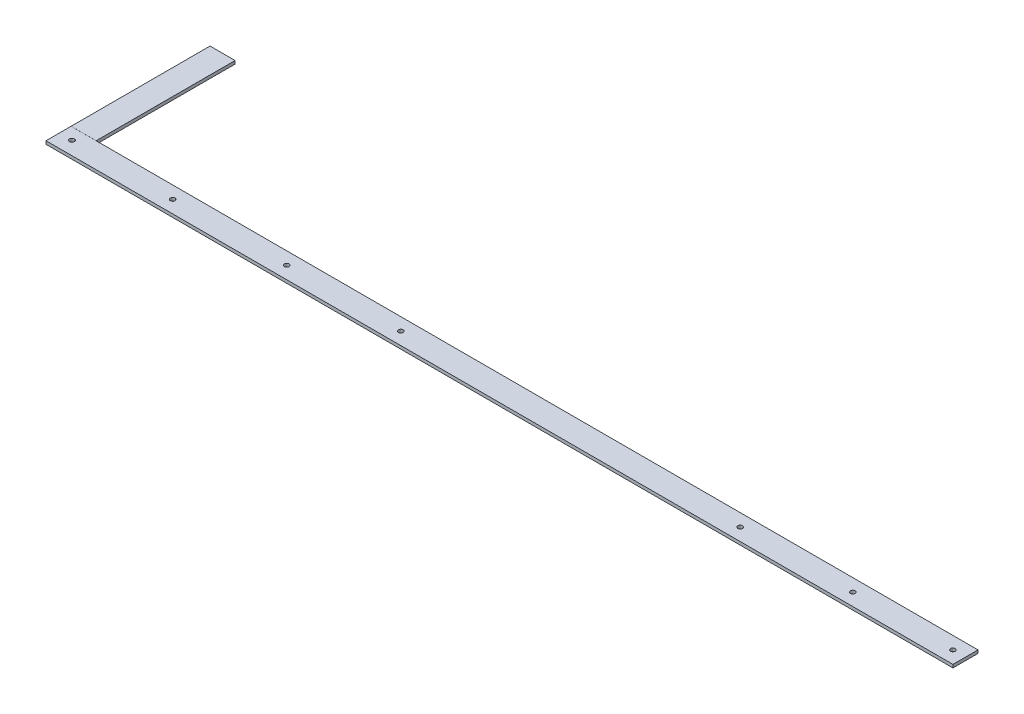
from build123d import *

# Parameters (mm, degrees)
CROQUIS2_W              = 50.8
CROQUIS2_H              = 128.69
SALIENTE_EXTRUIR1_DEPTH = 6.31
CROQUIS3_W              = 50.8
CROQUIS3_H              = 6.31
SALIENTE_EXTRUIR2_DEPTH = 507.13
CROQUIS4_W              = 50.8
CROQUIS4_H              = 6.31
SALIENTE_EXTRUIR3_DEPTH = 1787.3
CROQUIS9_W              = 50.8
CROQUIS9_H              = 6.31
SALIENTE_EXTRUIR4_DEPTH = 98
CROQUIS12_R             = 5
CORTAR_EXTRUIR1_DEPTH   = 10
CORTAR_EXTRUIR2_DEPTH   = 73
CROQUIS16_W             = 47.2
CROQUIS16_H             = 71.54029971
CORTAR_EXTRUIR5_DEPTH   = 10
CROQUIS25_W             = 50.8
CROQUIS25_H             = 0.1
CORTAR_EXTRUIR14_DEPTH  = 50.8
CROQUIS24_W             = 50.8
CROQUIS24_H             = 0.1
CORTAR_EXTRUIR15_DEPTH  = 50.8
CROQUIS26_R             = 4.7625
CORTAR_EXTRUIR16_DEPTH  = 33
CROQUIS27_R             = 5
CORTAR_EXTRUIR17_DEPTH  = 33
CROQUIS32_R             = 5
CORTAR_EXTRUIR22_DEPTH  = 50
CROQUIS33_R             = 5
CORTAR_EXTRUIR23_DEPTH  = 50
CROQUIS34_R             = 4.765
CROQUIS34_R_2           = 4.7625
CORTAR_EXTRUIR24_DEPTH  = 10
CROQUIS35_R             = 4.765
CROQUIS35_R_2           = 4.7625
CORTAR_EXTRUIR25_DEPTH  = 10
CROQUIS36_R             = 5
CORTAR_EXTRUIR26_DEPTH  = 10
CROQUIS37_W             = 50.8
CROQUIS37_H             = 6.31
SALIENTE_EXTRUIR5_DEPTH = 100
CORTAR_EXTRUIR27_DEPTH  = 135
CROQUIS40_W             = 50.8
CROQUIS40_H             = 181
CORTAR_EXTRUIR28_DEPTH  = 74
CROQUIS42_W             = 161.497999248
CROQUIS42_H             = 238.597734352
CORTAR_EXTRUIR30_DEPTH  = 87


with BuildPart() as part:
    # Croquis2 → Saliente-Extruir1 (new body)
    with BuildSketch(Plane.XY):
        Rectangle(CROQUIS2_W, CROQUIS2_H)
    extrude(amount=SALIENTE_EXTRUIR1_DEPTH)

    # Croquis3 → Saliente-Extruir2 (add)
    with BuildSketch(Plane.XY.offset(6.31)):
        with Locations((0, -61.19)):
            Rectangle(CROQUIS3_W, CROQUIS3_H)
    extrude(amount=SALIENTE_EXTRUIR2_DEPTH)

    # Croquis4 → Saliente-Extruir3 (add)
    with BuildSketch(Plane(origin=(25.4, 0, 0), x_dir=(0, 0, -1), z_dir=(1, 0, 0))):
        with Locations((-488.04, -61.19)):
            Rectangle(CROQUIS4_W, CROQUIS4_H)
    extrude(amount=SALIENTE_EXTRUIR3_DEPTH)

    # Barrer2: sweep along a curve in space
    with BuildLine() as barrer2_path:
        Line((1787.3, -61.19, 513.44), (1787.3, -61.19, 629.44))
        Line((1787.3, -61.19, 629.44), (1787.3, 63.52, 629.44))
        Line((1787.3, 63.52, 629.44), (1787.3, 63.52, 1423.44))
    # Croquis9 → Barrer2 (sweep)
    with BuildSketch(Plane.XY.offset(513.44)):
        with Locations((1787.3, -61.19)):
            Rectangle(CROQUIS9_W, CROQUIS9_H)
    sweep(path=barrer2_path.line, transition=Transition.RIGHT)

    # Croquis11 → Saliente-Extruir4 (add)
    with BuildSketch(Plane.ZY.offset(25.4)):
        Polygon((0, 64.345), (-33.068312374, 124.322347428), (-27.542535245, 127.368966394), (6.31, 64.345), align=None)
    extrude(amount=-SALIENTE_EXTRUIR4_DEPTH)

    # Croquis12 → Cortar-Extruir1 (cut)
    with BuildSketch(Plane(origin=(0, 66.675, 0), x_dir=(1, 0, 0), z_dir=(0, 1, 0))):
        with Locations((1787.3, -1390.44)):
            Circle(CROQUIS12_R)
        with Locations((1787.3, -1170.44)):
            Circle(CROQUIS12_R)
    extrude(amount=-CORTAR_EXTRUIR1_DEPTH, mode=Mode.SUBTRACT)

    # Croquis13 → Cortar-Extruir2 (cut)
    with BuildSketch(Plane(origin=(1812.7, 0, 0), x_dir=(0, 0, -1), z_dir=(1, 0, 0))):
        Polygon((-632.595, 53.56128726), (-626.285, 53.56128726), (-626.285, 66.675), (-1423.44, 66.675), (-1423.44, 60.365), (-632.595, 60.365), align=None)
    extrude(amount=-CORTAR_EXTRUIR2_DEPTH, mode=Mode.SUBTRACT)

    # Croquis16 → Cortar-Extruir5 (cut)
    with BuildSketch(Plane(origin=(0, 17.038152429, 31.720281459), x_dir=(1, 0, 0), z_dir=(0, 0.4731953232328629, 0.880957539311939))):
        with Locations((49, 89.469500232)):
            Rectangle(CROQUIS16_W, CROQUIS16_H)
    extrude(amount=-CORTAR_EXTRUIR5_DEPTH, mode=Mode.SUBTRACT)

    # Croquis25 → Cortar-Extruir14 (cut)
    with BuildSketch(Plane(origin=(0, -58.035, 0), x_dir=(1, 0, 0), z_dir=(0, 1, 0))):
        with Locations((1787.3, -513.49)):
            Rectangle(CROQUIS25_W, CROQUIS25_H)
    extrude(amount=-CORTAR_EXTRUIR14_DEPTH, mode=Mode.SUBTRACT)


with BuildPart() as cortar_extruir14_piece_1:
    # of the separate pieces the step leaves, piece 1, a body of its own (cortar_extruir14_pieces)
    add(part.part.solids().sort_by_distance((-25.4, -58.035, 6.31))[0])

    # Croquis24 → Cortar-Extruir15 (cut)
    with BuildSketch(Plane(origin=(0, -58.035, 0), x_dir=(1, 0, 0), z_dir=(0, 1, 0))):
        with Locations((0, -462.59)):
            Rectangle(CROQUIS24_W, CROQUIS24_H)
    extrude(amount=-CORTAR_EXTRUIR15_DEPTH, mode=Mode.SUBTRACT)


with BuildPart() as cortar_extruir14_piece_2:
    # of the separate pieces the step leaves, piece 2, a body of its own (cortar_extruir14_pieces)
    add(part.part.solids().sort_by_distance((1812.7, -58.035, 513.54))[0])

    # Croquis27 → Cortar-Extruir17 (cut)
    with BuildSketch(Plane(origin=(0, 0, 626.285), x_dir=(-1, 0, 0), z_dir=(0, 0, -1))):
        with Locations((-1787.3, 19.56128726)):
            Circle(CROQUIS27_R)
    extrude(amount=-CORTAR_EXTRUIR17_DEPTH, mode=Mode.SUBTRACT)

    # Croquis37 → Saliente-Extruir5 (add)
    with BuildSketch(Plane(origin=(0, 53.56128726, 0), x_dir=(1, 0, 0), z_dir=(0, 1, 0))):
        with Locations((1787.3, -629.44)):
            Rectangle(CROQUIS37_W, CROQUIS37_H)
    extrude(amount=SALIENTE_EXTRUIR5_DEPTH)

    # Croquis42 → Cortar-Extruir30 (cut)
    with BuildSketch(Plane(origin=(1812.7, 0, 0), x_dir=(0, 0, -1), z_dir=(1, 0, 0))):
        with Locations((-594.288999624, 54.953867176)):
            Rectangle(CROQUIS42_W, CROQUIS42_H)
    extrude(amount=-CORTAR_EXTRUIR30_DEPTH, mode=Mode.SUBTRACT)


with BuildPart() as cortar_extruir15_piece_1:
    # of the separate pieces the step leaves, piece 1, a body of its own (cortar_extruir15_pieces)
    add(cortar_extruir14_piece_1.part.solids().sort_by_distance((-25.4, -58.035, 462.64))[0])

    # Croquis26 → Cortar-Extruir16 (cut)
    with BuildSketch(Plane(origin=(0, -58.035, 0), x_dir=(1, 0, 0), z_dir=(0, 1, 0))):
        with Locations((1787.3, -488.04)):
            Circle(CROQUIS26_R)
    extrude(amount=-CORTAR_EXTRUIR16_DEPTH, mode=Mode.SUBTRACT)

    # Croquis32 → Cortar-Extruir22 (cut)
    with BuildSketch(Plane(origin=(0, -58.035, 0), x_dir=(1, 0, 0), z_dir=(0, 1, 0))):
        with Locations((0, -486.34)):
            Circle(CROQUIS32_R)
    extrude(amount=-CORTAR_EXTRUIR22_DEPTH, mode=Mode.SUBTRACT)

    # Croquis35 → Cortar-Extruir25 (cut)
    with BuildSketch(Plane(origin=(0, -58.035, 0), x_dir=(1, 0, 0), z_dir=(0, 1, 0))):
        with Locations((1584.418928683, -488.04)):
            Circle(CROQUIS35_R)
        with Locations((1356.137857365, -488.04)):
            Circle(CROQUIS35_R)
        with Locations((668.331786048, -488.04)):
            Circle(CROQUIS35_R)
        with Locations((437.087857365, -488.04)):
            Circle(CROQUIS35_R)
        with Locations((205.843928683, -488.04)):
            Circle(CROQUIS35_R_2)
    extrude(amount=-CORTAR_EXTRUIR25_DEPTH, mode=Mode.SUBTRACT)


with BuildPart() as cortar_extruir15_piece_2:
    # of the separate pieces the step leaves, piece 2, a body of its own (cortar_extruir15_pieces)
    add(cortar_extruir14_piece_1.part.solids().sort_by_distance((-25.4, -58.035, 6.31))[0])

    # Croquis33 → Cortar-Extruir23 (cut)
    with BuildSketch(Plane(origin=(0, 17.038152429, 31.720281459), x_dir=(1, 0, 0), z_dir=(0, 0.473195323232863, 0.8809575393119389))):
        with Locations((0, 98.119650087)):
            Circle(CROQUIS33_R)
    extrude(amount=-CORTAR_EXTRUIR23_DEPTH, mode=Mode.SUBTRACT)

    # Croquis34 → Cortar-Extruir24 (cut)
    with BuildSketch(Plane.XY.offset(6.31)):
        with Locations((12.7, -27.44)):
            Circle(CROQUIS34_R)
        with Locations((-12.7, 33.75)):
            Circle(CROQUIS34_R_2)
    extrude(amount=-CORTAR_EXTRUIR24_DEPTH, mode=Mode.SUBTRACT)

    # Croquis36 → Cortar-Extruir26 (cut)
    with BuildSketch(Plane(origin=(0, -58.035, 0), x_dir=(1, 0, 0), z_dir=(0, 1, 0))):
        with Locations((0, -105.807204666)):
            Circle(CROQUIS36_R)
    extrude(amount=-CORTAR_EXTRUIR26_DEPTH, mode=Mode.SUBTRACT)

    # Croquis39 → Cortar-Extruir27 (cut)
    with BuildSketch(Plane.ZY.offset(25.4)):
        Polygon((6.31, -58.035), (0, -58.035), (0, 64.345), (-33.068312374, 124.322347428), (-27.542535245, 127.368966394), (6.31, 64.345), align=None)
    extrude(amount=-CORTAR_EXTRUIR27_DEPTH, mode=Mode.SUBTRACT)

    # Croquis40 → Cortar-Extruir28 (cut)
    with BuildSketch(Plane(origin=(0, -58.035, 0), x_dir=(1, 0, 0), z_dir=(0, 1, 0))):
        with Locations((0, -90.5)):
            Rectangle(CROQUIS40_W, CROQUIS40_H)
    extrude(amount=-CORTAR_EXTRUIR28_DEPTH, mode=Mode.SUBTRACT)


solid = Compound([cortar_extruir15_piece_1.part, cortar_extruir15_piece_2.part])
